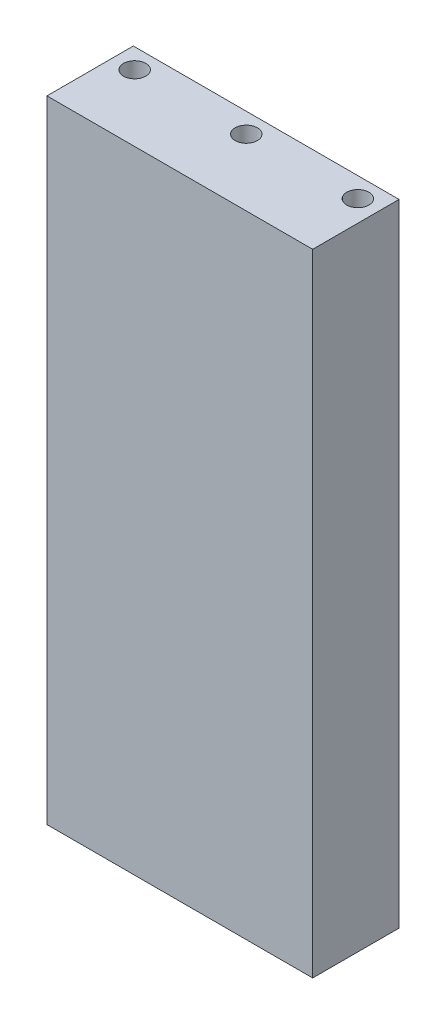
from build123d import *

# Parameters (mm, degrees)
SKETCH1_W           = 50.8
SKETCH1_H           = 7.62
SKETCH1_R           = 2.12725
BOSS_EXTRUDE1_DEPTH = 60.325
SKETCH2_W           = 50.8
SKETCH2_H           = 8.89
BOSS_EXTRUDE2_DEPTH = 60.325


with BuildPart() as part:
    # Sketch1 → Boss-Extrude1 (new, symmetric)
    with BuildSketch(Plane(origin=(0, 0, 0), x_dir=(1, 0, 0), z_dir=(0, 1, 0))):
        with Locations((-9.079617512, 57.044833819)):
            Rectangle(SKETCH1_W, SKETCH1_H)
        with Locations(Location((-30.415617512, 57.044833819, 0), (0, 0, 90))):
            Circle(SKETCH1_R, mode=Mode.SUBTRACT)
        with Locations(Location((-9.079617512, 57.044833819, 0), (0, 0, 90))):
            Circle(SKETCH1_R, mode=Mode.SUBTRACT)
        with Locations(Location((12.256382488, 57.044833819, 0), (0, 0, 90))):
            Circle(SKETCH1_R, mode=Mode.SUBTRACT)
    extrude(amount=BOSS_EXTRUDE1_DEPTH, both=True)

    # Sketch2 → Boss-Extrude2 (add, symmetric)
    with BuildSketch(Plane(origin=(0, 0, 0), x_dir=(1, 0, 0), z_dir=(0, 1, 0))):
        with Locations((-9.079617512, 48.789833819)):
            Rectangle(SKETCH2_W, SKETCH2_H)
    extrude(amount=BOSS_EXTRUDE2_DEPTH, both=True)


solid = part.part
